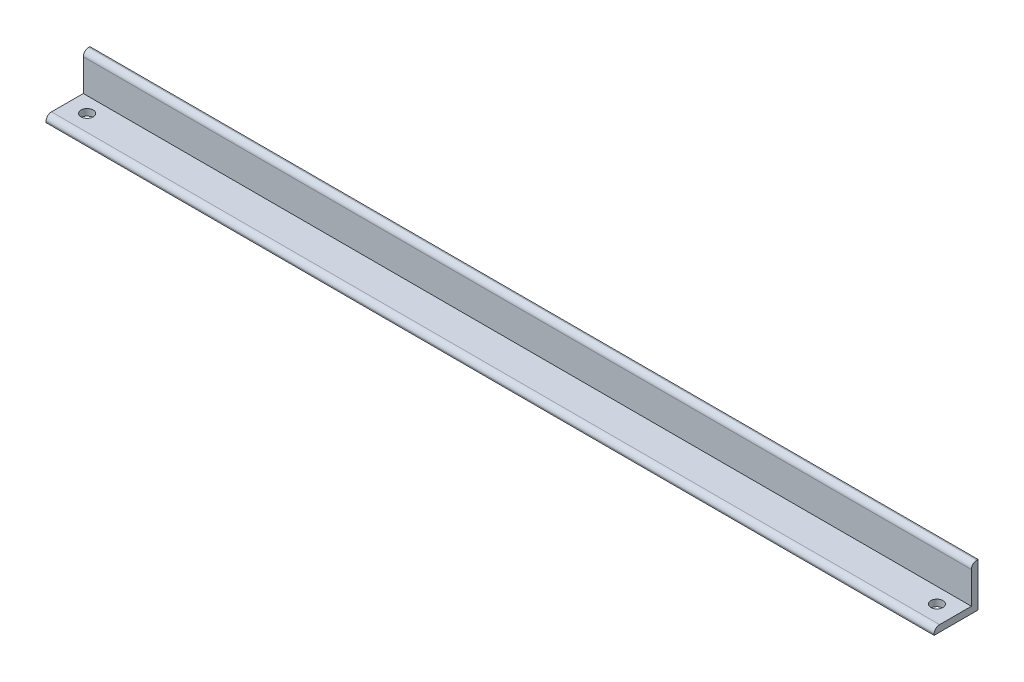
from build123d import *

# Parameters (mm, degrees)
SKETCH_1_W             = 1619
SKETCH_1_H             = 80
EXTRUDE_1_DEPTH        = 80
SKETCH_3_W             = 68
SKETCH_3_H             = 68
CUT_EXTRUDE_2_DEPTH    = 1623.948243167
FILLET_1_R             = 10
SKETCH_7_R             = 11
CUT_EXTRUDE_5_DEPTH    = 1623.948243167
PATTERN_LINEAR_3_COUNT = 2
PATTERN_LINEAR_3_PITCH = 1549.012588716


with BuildPart() as part:
    # 草图1 → 拉伸1 (new body)
    with BuildSketch(Plane.XY):
        with Locations((809.5, 40)):
            Rectangle(SKETCH_1_W, SKETCH_1_H)
    extrude(amount=EXTRUDE_1_DEPTH)

    # 草图3 → 拉伸2 (cut, through all)
    with BuildSketch(Plane.ZY):
        with Locations((46, 46)):
            Rectangle(SKETCH_3_W, SKETCH_3_H)
    extrude(amount=-CUT_EXTRUDE_2_DEPTH, mode=Mode.SUBTRACT)

    # 圆角1
    fillet_1_edges = [part.edges().sort_by_distance(p)[0] for p in [
        (809.5, 80, 12),
        (809.5, 12, 80),
    ]]
    fillet(fillet_1_edges, radius=FILLET_1_R)

    # 草图7 → 拉伸5 (cut, through all)
    with BuildSketch(Plane.XZ):
        with Locations(Location((35, 40, 0), (0, 0, 270))):
            Circle(SKETCH_7_R)
    cut_extrude_5 = extrude(amount=-CUT_EXTRUDE_5_DEPTH, mode=Mode.SUBTRACT)

    # 阵列(线性)3: 拉伸5 ×2
    with Locations(*[(i * PATTERN_LINEAR_3_PITCH, 0, 0) for i in range(1, PATTERN_LINEAR_3_COUNT)]):
        add(cut_extrude_5, mode=Mode.SUBTRACT)


solid = part.part
